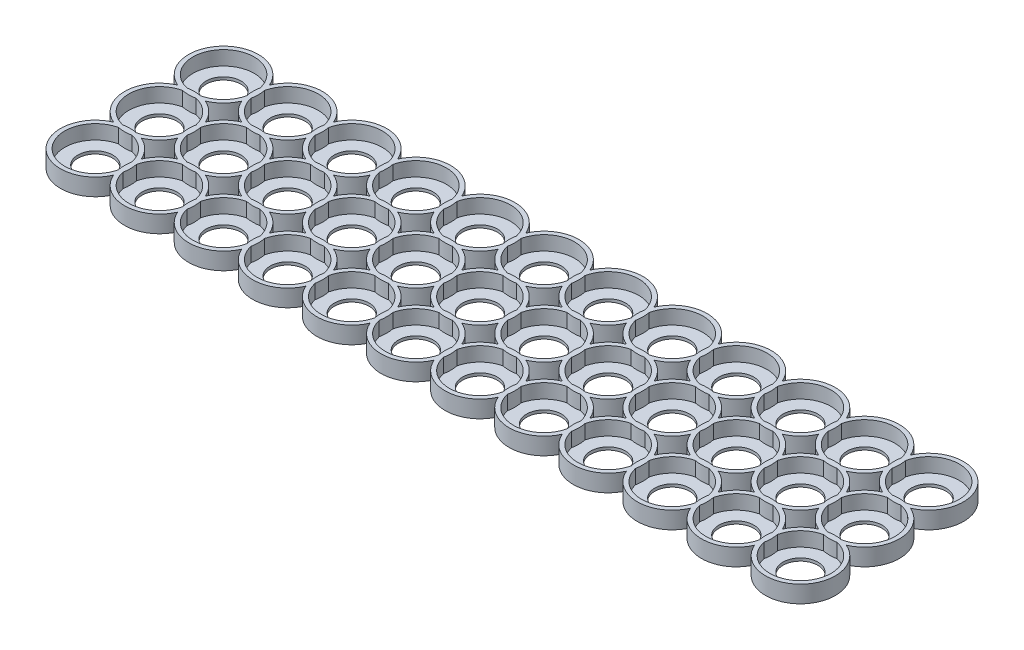
from build123d import *

# Parameters (mm, degrees)
LPATTERN1_COUNT = 3
LPATTERN1_PITCH = 22.5
LPATTERN2_COUNT = 12
LPATTERN2_PITCH = 22.5


with BuildPart() as part:
    # Sketch1 → Revolve1 (revolve)
    with BuildSketch(Plane(origin=(0, 0, 0), x_dir=(0, 0, -1), z_dir=(1, 0, 0))):
        Polygon((-12.25, 3), (-12.25, -3), (-6.125, -3), (-6.125, -2), (-10.75, -2), (-10.75, 3), align=None)
    revolve1 = revolve(axis=Axis((0, 27.077205882, 0), (0, -1, 0)))

    # LPattern1: Revolve1 ×3
    with Locations(*[(0, 0, -i * LPATTERN1_PITCH) for i in range(1, LPATTERN1_COUNT)]):
        add(revolve1)

    # LPattern2: Revolve1 ×12
    with Locations(*[(i * LPATTERN2_PITCH, 0, 0) for i in range(1, LPATTERN2_COUNT)]):
        add(revolve1)

    # LPattern2 copy 1 sketch → LPattern2 copy 1 (revolve)
    with BuildSketch(Plane(origin=(22.5, 0, -22.5), x_dir=(0, 0, -1), z_dir=(1, 0, 0))):
        Polygon((-12.25, 3), (-12.25, -3), (-6.125, -3), (-6.125, -2), (-10.75, -2), (-10.75, 3), align=None)
    revolve(axis=Axis((22.5, 27.077205882, -22.5), (0, -1, 0)))

    # LPattern2 copy 2 sketch → LPattern2 copy 2 (revolve)
    with BuildSketch(Plane(origin=(45, 0, -22.5), x_dir=(0, 0, -1), z_dir=(1, 0, 0))):
        Polygon((-12.25, 3), (-12.25, -3), (-6.125, -3), (-6.125, -2), (-10.75, -2), (-10.75, 3), align=None)
    revolve(axis=Axis((45, 27.077205882, -22.5), (0, -1, 0)))

    # LPattern2 copy 3 sketch → LPattern2 copy 3 (revolve)
    with BuildSketch(Plane(origin=(67.5, 0, -22.5), x_dir=(0, 0, -1), z_dir=(1, 0, 0))):
        Polygon((-12.25, 3), (-12.25, -3), (-6.125, -3), (-6.125, -2), (-10.75, -2), (-10.75, 3), align=None)
    revolve(axis=Axis((67.5, 27.077205882, -22.5), (0, -1, 0)))

    # LPattern2 copy 4 sketch → LPattern2 copy 4 (revolve)
    with BuildSketch(Plane(origin=(90, 0, -22.5), x_dir=(0, 0, -1), z_dir=(1, 0, 0))):
        Polygon((-12.25, 3), (-12.25, -3), (-6.125, -3), (-6.125, -2), (-10.75, -2), (-10.75, 3), align=None)
    revolve(axis=Axis((90, 27.077205882, -22.5), (0, -1, 0)))

    # LPattern2 copy 5 sketch → LPattern2 copy 5 (revolve)
    with BuildSketch(Plane(origin=(112.5, 0, -22.5), x_dir=(0, 0, -1), z_dir=(1, 0, 0))):
        Polygon((-12.25, 3), (-12.25, -3), (-6.125, -3), (-6.125, -2), (-10.75, -2), (-10.75, 3), align=None)
    revolve(axis=Axis((112.5, 27.077205882, -22.5), (0, -1, 0)))

    # LPattern2 copy 6 sketch → LPattern2 copy 6 (revolve)
    with BuildSketch(Plane(origin=(135, 0, -22.5), x_dir=(0, 0, -1), z_dir=(1, 0, 0))):
        Polygon((-12.25, 3), (-12.25, -3), (-6.125, -3), (-6.125, -2), (-10.75, -2), (-10.75, 3), align=None)
    revolve(axis=Axis((135, 27.077205882, -22.5), (0, -1, 0)))

    # LPattern2 copy 7 sketch → LPattern2 copy 7 (revolve)
    with BuildSketch(Plane(origin=(157.5, 0, -22.5), x_dir=(0, 0, -1), z_dir=(1, 0, 0))):
        Polygon((-12.25, 3), (-12.25, -3), (-6.125, -3), (-6.125, -2), (-10.75, -2), (-10.75, 3), align=None)
    revolve(axis=Axis((157.5, 27.077205882, -22.5), (0, -1, 0)))

    # LPattern2 copy 8 sketch → LPattern2 copy 8 (revolve)
    with BuildSketch(Plane(origin=(180, 0, -22.5), x_dir=(0, 0, -1), z_dir=(1, 0, 0))):
        Polygon((-12.25, 3), (-12.25, -3), (-6.125, -3), (-6.125, -2), (-10.75, -2), (-10.75, 3), align=None)
    revolve(axis=Axis((180, 27.077205882, -22.5), (0, -1, 0)))

    # LPattern2 copy 9 sketch → LPattern2 copy 9 (revolve)
    with BuildSketch(Plane(origin=(202.5, 0, -22.5), x_dir=(0, 0, -1), z_dir=(1, 0, 0))):
        Polygon((-12.25, 3), (-12.25, -3), (-6.125, -3), (-6.125, -2), (-10.75, -2), (-10.75, 3), align=None)
    revolve(axis=Axis((202.5, 27.077205882, -22.5), (0, -1, 0)))

    # LPattern2 copy 10 sketch → LPattern2 copy 10 (revolve)
    with BuildSketch(Plane(origin=(225, 0, -22.5), x_dir=(0, 0, -1), z_dir=(1, 0, 0))):
        Polygon((-12.25, 3), (-12.25, -3), (-6.125, -3), (-6.125, -2), (-10.75, -2), (-10.75, 3), align=None)
    revolve(axis=Axis((225, 27.077205882, -22.5), (0, -1, 0)))

    # LPattern2 copy 11 sketch → LPattern2 copy 11 (revolve)
    with BuildSketch(Plane(origin=(247.5, 0, -22.5), x_dir=(0, 0, -1), z_dir=(1, 0, 0))):
        Polygon((-12.25, 3), (-12.25, -3), (-6.125, -3), (-6.125, -2), (-10.75, -2), (-10.75, 3), align=None)
    revolve(axis=Axis((247.5, 27.077205882, -22.5), (0, -1, 0)))

    # LPattern2 copy 12 sketch → LPattern2 copy 12 (revolve)
    with BuildSketch(Plane(origin=(22.5, 0, -45), x_dir=(0, 0, -1), z_dir=(1, 0, 0))):
        Polygon((-12.25, 3), (-12.25, -3), (-6.125, -3), (-6.125, -2), (-10.75, -2), (-10.75, 3), align=None)
    revolve(axis=Axis((22.5, 27.077205882, -45), (0, -1, 0)))

    # LPattern2 copy 13 sketch → LPattern2 copy 13 (revolve)
    with BuildSketch(Plane(origin=(45, 0, -45), x_dir=(0, 0, -1), z_dir=(1, 0, 0))):
        Polygon((-12.25, 3), (-12.25, -3), (-6.125, -3), (-6.125, -2), (-10.75, -2), (-10.75, 3), align=None)
    revolve(axis=Axis((45, 27.077205882, -45), (0, -1, 0)))

    # LPattern2 copy 14 sketch → LPattern2 copy 14 (revolve)
    with BuildSketch(Plane(origin=(67.5, 0, -45), x_dir=(0, 0, -1), z_dir=(1, 0, 0))):
        Polygon((-12.25, 3), (-12.25, -3), (-6.125, -3), (-6.125, -2), (-10.75, -2), (-10.75, 3), align=None)
    revolve(axis=Axis((67.5, 27.077205882, -45), (0, -1, 0)))

    # LPattern2 copy 15 sketch → LPattern2 copy 15 (revolve)
    with BuildSketch(Plane(origin=(90, 0, -45), x_dir=(0, 0, -1), z_dir=(1, 0, 0))):
        Polygon((-12.25, 3), (-12.25, -3), (-6.125, -3), (-6.125, -2), (-10.75, -2), (-10.75, 3), align=None)
    revolve(axis=Axis((90, 27.077205882, -45), (0, -1, 0)))

    # LPattern2 copy 16 sketch → LPattern2 copy 16 (revolve)
    with BuildSketch(Plane(origin=(112.5, 0, -45), x_dir=(0, 0, -1), z_dir=(1, 0, 0))):
        Polygon((-12.25, 3), (-12.25, -3), (-6.125, -3), (-6.125, -2), (-10.75, -2), (-10.75, 3), align=None)
    revolve(axis=Axis((112.5, 27.077205882, -45), (0, -1, 0)))

    # LPattern2 copy 17 sketch → LPattern2 copy 17 (revolve)
    with BuildSketch(Plane(origin=(135, 0, -45), x_dir=(0, 0, -1), z_dir=(1, 0, 0))):
        Polygon((-12.25, 3), (-12.25, -3), (-6.125, -3), (-6.125, -2), (-10.75, -2), (-10.75, 3), align=None)
    revolve(axis=Axis((135, 27.077205882, -45), (0, -1, 0)))

    # LPattern2 copy 18 sketch → LPattern2 copy 18 (revolve)
    with BuildSketch(Plane(origin=(157.5, 0, -45), x_dir=(0, 0, -1), z_dir=(1, 0, 0))):
        Polygon((-12.25, 3), (-12.25, -3), (-6.125, -3), (-6.125, -2), (-10.75, -2), (-10.75, 3), align=None)
    revolve(axis=Axis((157.5, 27.077205882, -45), (0, -1, 0)))

    # LPattern2 copy 19 sketch → LPattern2 copy 19 (revolve)
    with BuildSketch(Plane(origin=(180, 0, -45), x_dir=(0, 0, -1), z_dir=(1, 0, 0))):
        Polygon((-12.25, 3), (-12.25, -3), (-6.125, -3), (-6.125, -2), (-10.75, -2), (-10.75, 3), align=None)
    revolve(axis=Axis((180, 27.077205882, -45), (0, -1, 0)))

    # LPattern2 copy 20 sketch → LPattern2 copy 20 (revolve)
    with BuildSketch(Plane(origin=(202.5, 0, -45), x_dir=(0, 0, -1), z_dir=(1, 0, 0))):
        Polygon((-12.25, 3), (-12.25, -3), (-6.125, -3), (-6.125, -2), (-10.75, -2), (-10.75, 3), align=None)
    revolve(axis=Axis((202.5, 27.077205882, -45), (0, -1, 0)))

    # LPattern2 copy 21 sketch → LPattern2 copy 21 (revolve)
    with BuildSketch(Plane(origin=(225, 0, -45), x_dir=(0, 0, -1), z_dir=(1, 0, 0))):
        Polygon((-12.25, 3), (-12.25, -3), (-6.125, -3), (-6.125, -2), (-10.75, -2), (-10.75, 3), align=None)
    revolve(axis=Axis((225, 27.077205882, -45), (0, -1, 0)))

    # LPattern2 copy 22 sketch → LPattern2 copy 22 (revolve)
    with BuildSketch(Plane(origin=(247.5, 0, -45), x_dir=(0, 0, -1), z_dir=(1, 0, 0))):
        Polygon((-12.25, 3), (-12.25, -3), (-6.125, -3), (-6.125, -2), (-10.75, -2), (-10.75, 3), align=None)
    revolve(axis=Axis((247.5, 27.077205882, -45), (0, -1, 0)))


solid = part.part
